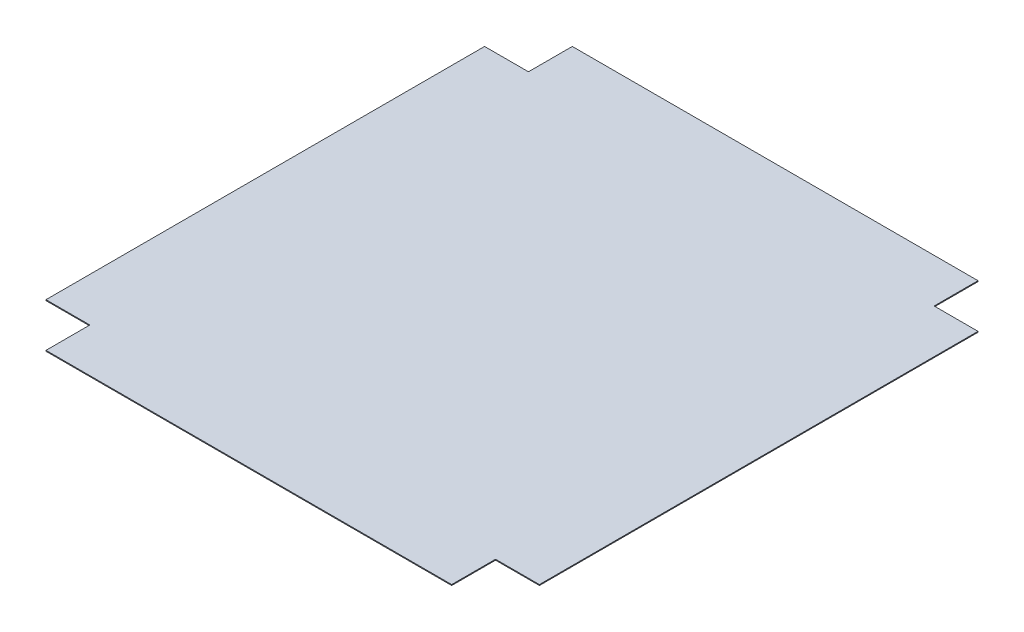
from build123d import *

# Parameters (mm, degrees)
BOSS_EXTRUDE1_DEPTH = 0.4064


with BuildPart() as part:
    # Sketch1 → Boss-Extrude1 (new body)
    with BuildSketch(Plane(origin=(0, 0, 0), x_dir=(1, 0, 0), z_dir=(0, 1, 0))):
        Polygon((-92.5, 120), (-92.5, 100.000000122), (-112.5, 100.000000122), (-112.5, -100.000000122), (-92.5, -100.000000122), (-92.5, -120), (92.5, -120), (92.5, -100.000000122), (112.5, -100.000000122), (112.5, 100.000000122), (92.5, 100.000000122), (92.5, 120), align=None)
    extrude(amount=BOSS_EXTRUDE1_DEPTH)


solid = part.part
